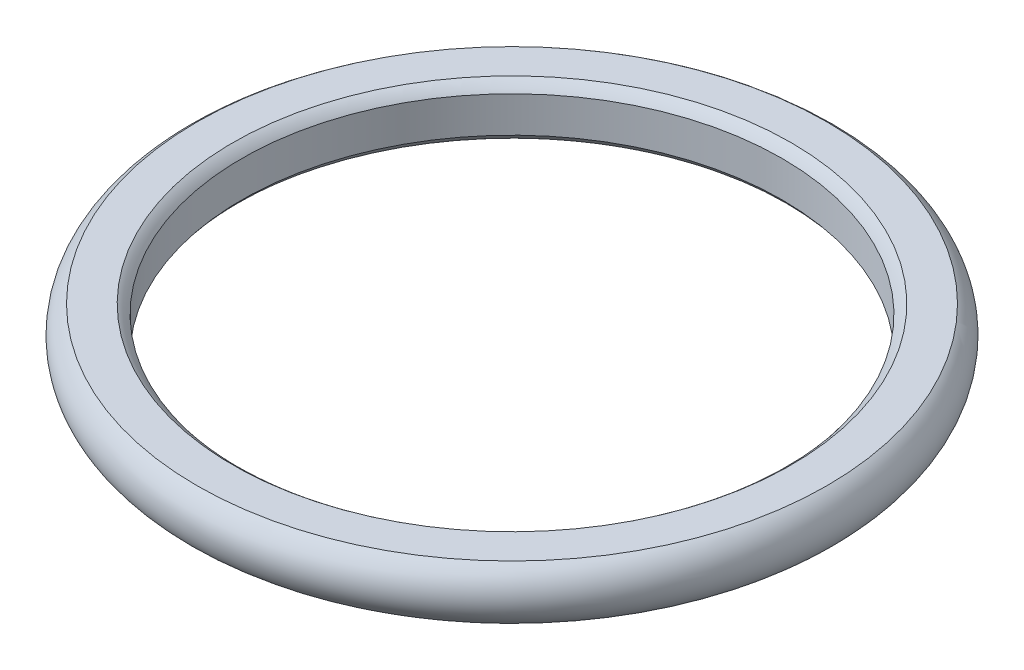
from build123d import *

# Parameters (mm, degrees)
SKETCH_2_R          = 3
SKETCH_3_R          = 25
CUT_EXTRUDE_1_DEPTH = 5
SKETCH_4_R          = 35
CUT_EXTRUDE_2_DEPTH = 10


with BuildPart() as part:
    # ｽｹｯﾁ2 → 回転1 (revolve)
    with BuildSketch(Plane.XY, mode=Mode.PRIVATE) as revolve_1_sk:
        with Locations((27.5, 0)):
            Circle(SKETCH_2_R)
    revolve(revolve_1_sk.sketch.rotate(Axis((0, 0, 0), (0, 1, 0)), 90), axis=Axis((0, 0, 0), (0, 1, 0)))

    # ｽｹｯﾁ3 → ｶｯﾄ - 押し出し1 (cut, symmetric)
    with BuildSketch(Plane(origin=(0, 0, 0), x_dir=(1, 0, 0), z_dir=(0, 1, 0))):
        with Locations(Location((0, 0, 0), (0, 0, 90))):
            Circle(SKETCH_3_R)
    extrude(amount=CUT_EXTRUDE_1_DEPTH, both=True, mode=Mode.SUBTRACT)

    # ｽｹｯﾁ4 → ｶｯﾄ - 押し出し2 (cut)
    with BuildSketch(Plane(origin=(0, 2.5, 0), x_dir=(1, 0, 0), z_dir=(0, 1, 0))):
        Circle(SKETCH_4_R)
    extrude(amount=CUT_EXTRUDE_2_DEPTH, mode=Mode.SUBTRACT)


solid = part.part
